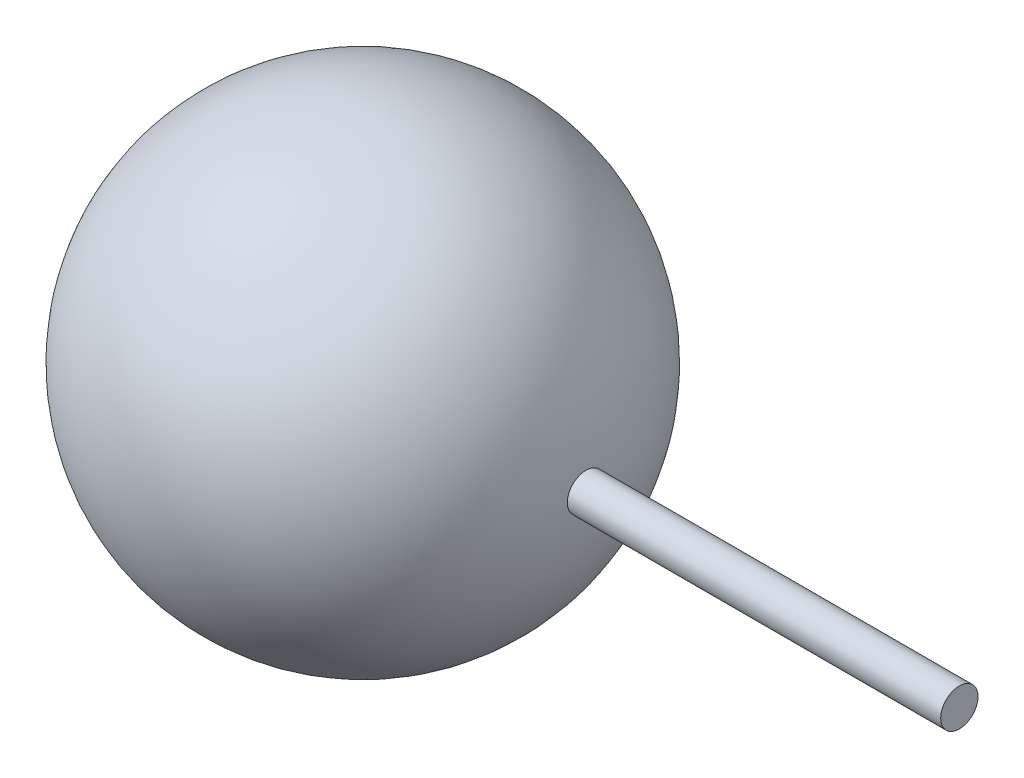
from build123d import *


with BuildPart() as part:
    # Sketch1 → Revolve1 (revolve)
    with BuildSketch(Plane.XY):
        with BuildLine():
            Line((2.989565186, 0.25), (7.989565186, 0.25))
            Line((7.989565186, 0.25), (7.989565186, 0))
            Line((7.989565186, 0), (-3, 0))
            ThreePointArc((-3, 0), (-0.125108838, 2.997390161), (2.989565186, 0.25))
        make_face()
    revolve(axis=Axis((0, 0, 0), (1, 0, 0)))


solid = part.part
